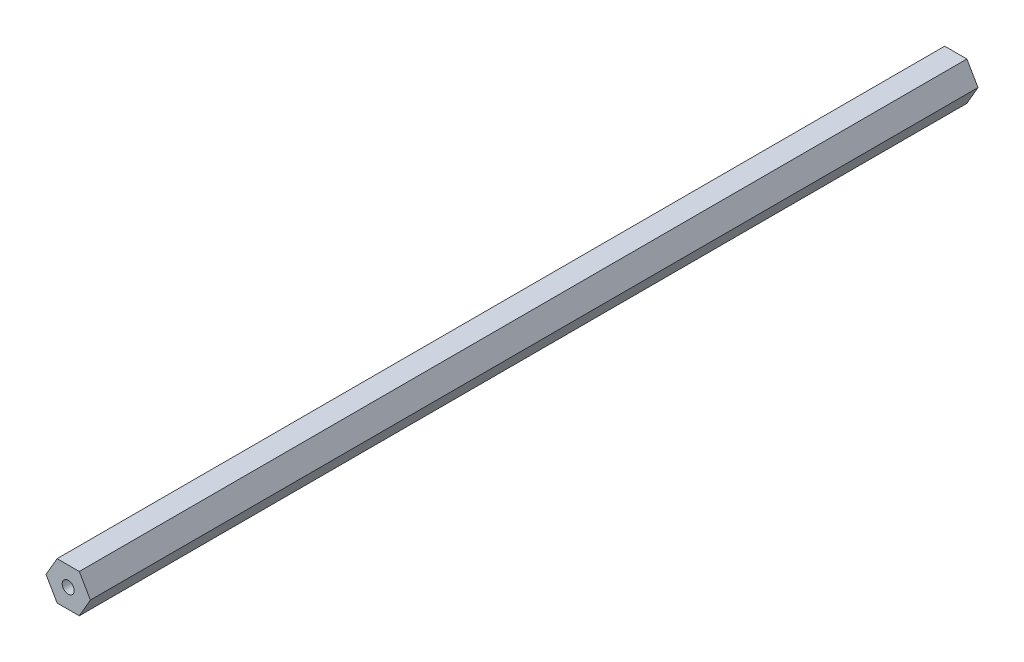
from build123d import *

# Parameters (mm, degrees)
SKETCH1_R           = 1.7145
BOSS_EXTRUDE1_DEPTH = 127


with BuildPart() as part:
    # Sketch1 → Boss-Extrude1 (new, symmetric)
    with BuildSketch(Plane.XY):
        Polygon((6.35, 0), (3.175, 5.499261314), (-3.175, 5.499261314), (-6.35, 0), (-3.175, -5.499261314), (3.175, -5.499261314), align=None)
        Circle(SKETCH1_R, mode=Mode.SUBTRACT)
    extrude(amount=BOSS_EXTRUDE1_DEPTH, both=True)


solid = part.part
